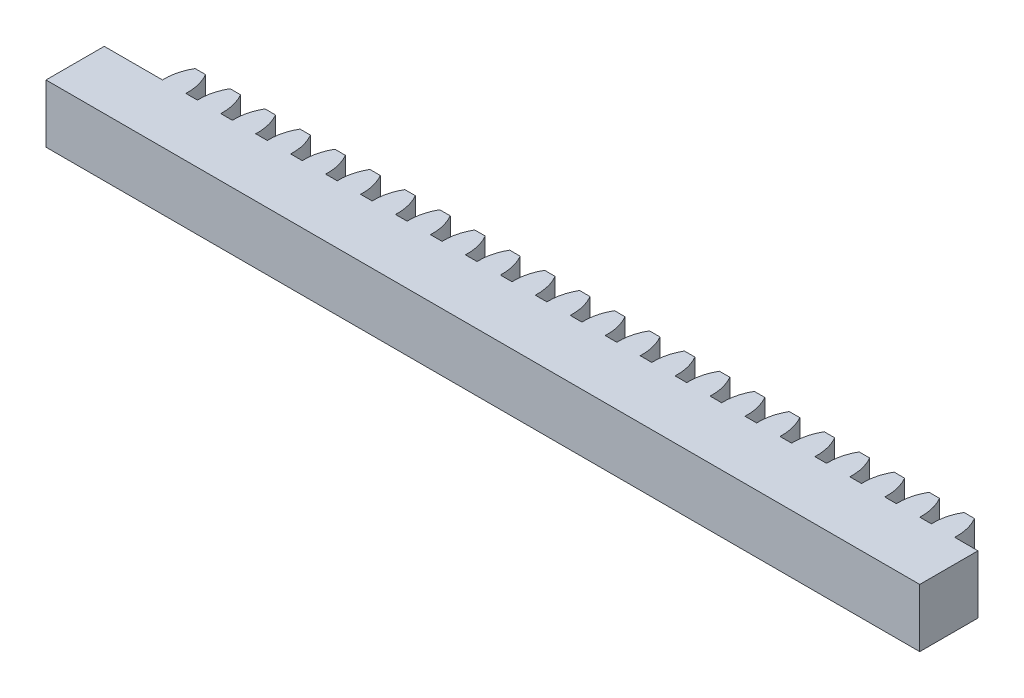
from build123d import *

# Parameters (mm, degrees)
BOSS_EXTRUDE1_DEPTH = 5
BOSS_EXTRUDE2_DEPTH = 5
LPATTERN1_COUNT     = 23
LPATTERN1_PITCH     = 3


with BuildPart() as part:
    # Sketch2 → Boss-Extrude1 (new body)
    with BuildSketch(Plane(origin=(0, 0, 0), x_dir=(1, 0, 0), z_dir=(0, 1, 0))):
        Polygon((-32.752808989, 5), (-32.752808989, 0), (42.247191011, 0), (42.247191011, 5), (-25.752808989, 5), (-27.752808989, 5), align=None)
    extrude(amount=BOSS_EXTRUDE1_DEPTH)

    # Sketch2<3> → Boss-Extrude2 (add)
    with BuildSketch(Plane(origin=(0, 0, 0), x_dir=(1, 0, 0), z_dir=(0, 1, 0))):
        with BuildLine():
            ThreePointArc((-27.202808989, 7.25), (-27.639277587, 6.164470102), (-27.752808989, 5))
            Line((-27.752808989, 5), (-25.752808989, 5))
            ThreePointArc((-25.752808989, 5), (-25.86634039, 6.164470102), (-26.302808989, 7.25))
            Line((-26.302808989, 7.25), (-27.202808989, 7.25))
        make_face()
    boss_extrude2 = extrude(amount=BOSS_EXTRUDE2_DEPTH)

    # LPattern1: Boss-Extrude2 ×23
    with Locations(*[(i * LPATTERN1_PITCH, 0, 0) for i in range(1, LPATTERN1_COUNT)]):
        add(boss_extrude2)


solid = part.part
